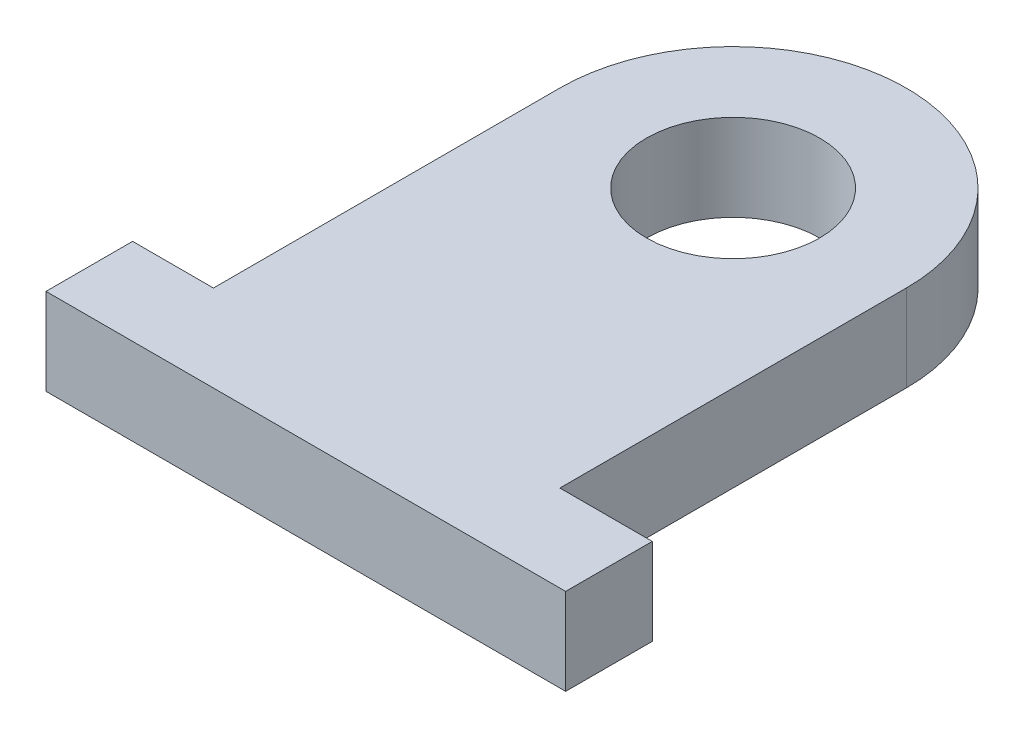
from build123d import *

# Parameters (mm, degrees)
SKETCH2_R           = 5
BOSS_EXTRUDE1_DEPTH = 5
SKETCH3_W           = 30
SKETCH3_H           = 5
BOSS_EXTRUDE2_DEPTH = 5


with BuildPart() as part:
    # Sketch2 → Boss-Extrude1 (new body)
    with BuildSketch(Plane(origin=(0, 0, 0), x_dir=(1, 0, 0), z_dir=(0, 1, 0))):
        with BuildLine():
            Line((-10, 0), (-10, -20))
            Line((-10, -20), (10, -20))
            Line((10, -20), (10, 0))
            ThreePointArc((10, 0), (0, 10), (-10, 0))
        make_face()
        with Locations(Location((0, 0, 0), (0, 0, 270))):
            Circle(SKETCH2_R, mode=Mode.SUBTRACT)
    extrude(amount=BOSS_EXTRUDE1_DEPTH)

    # Sketch3 → Boss-Extrude2 (add)
    with BuildSketch(Plane.XY.offset(20)):
        with Locations((0.334158143, 2.5)):
            Rectangle(SKETCH3_W, SKETCH3_H)
    extrude(amount=BOSS_EXTRUDE2_DEPTH)


solid = part.part
